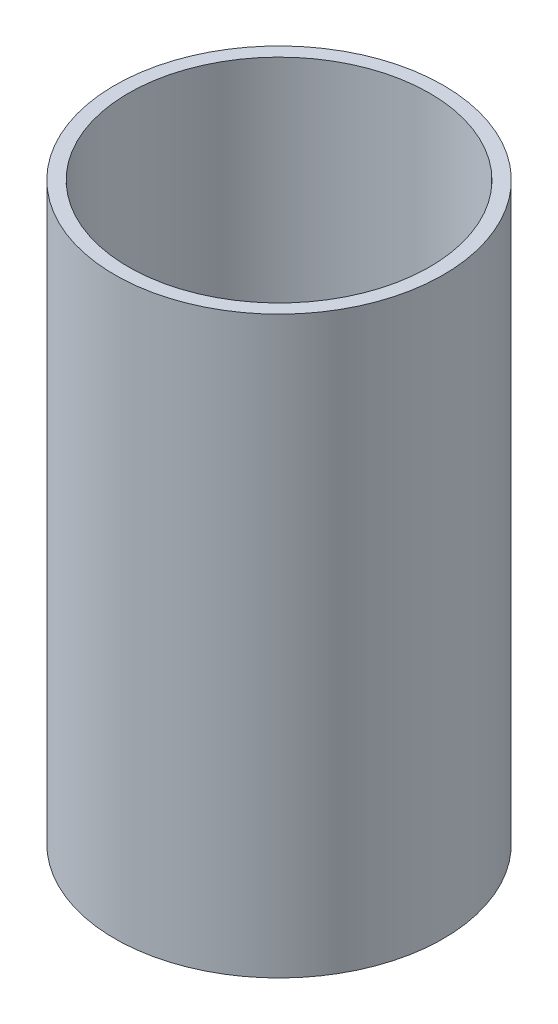
from build123d import *

# Parameters (mm, degrees)
SKETCH1_R           = 12
SKETCH1_R_2         = 11
BOSS_EXTRUDE1_DEPTH = 42


with BuildPart() as part:
    # Sketch1 → Boss-Extrude1 (new body)
    with BuildSketch(Plane(origin=(0, 0, 0), x_dir=(1, 0, 0), z_dir=(0, 1, 0))):
        with Locations(Location((0, 0, 0), (0, 0, 90))):
            Circle(SKETCH1_R)
        with Locations(Location((0, 0, 0), (0, 0, 90))):
            Circle(SKETCH1_R_2, mode=Mode.SUBTRACT)
    extrude(amount=BOSS_EXTRUDE1_DEPTH)


solid = part.part
